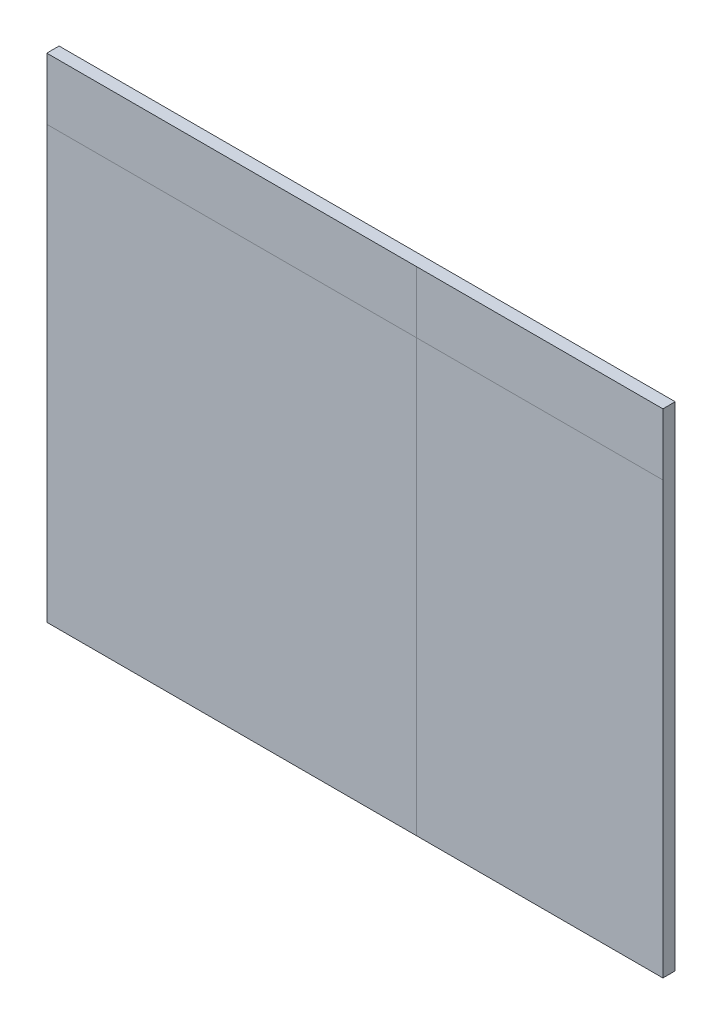
from build123d import *

# Parameters (mm, degrees)
SKETCH1_W      = 200000
SKETCH1_H      = 160000
EXTRUDE1_DEPTH = 4000


with BuildPart() as part:
    # Sketch1 → Extrude1 (new body)
    with BuildSketch(Plane.XY):
        with Locations((-100000, 4553.473798332)):
            Rectangle(SKETCH1_W, SKETCH1_H)
    extrude(amount=EXTRUDE1_DEPTH)


solid = part.part
